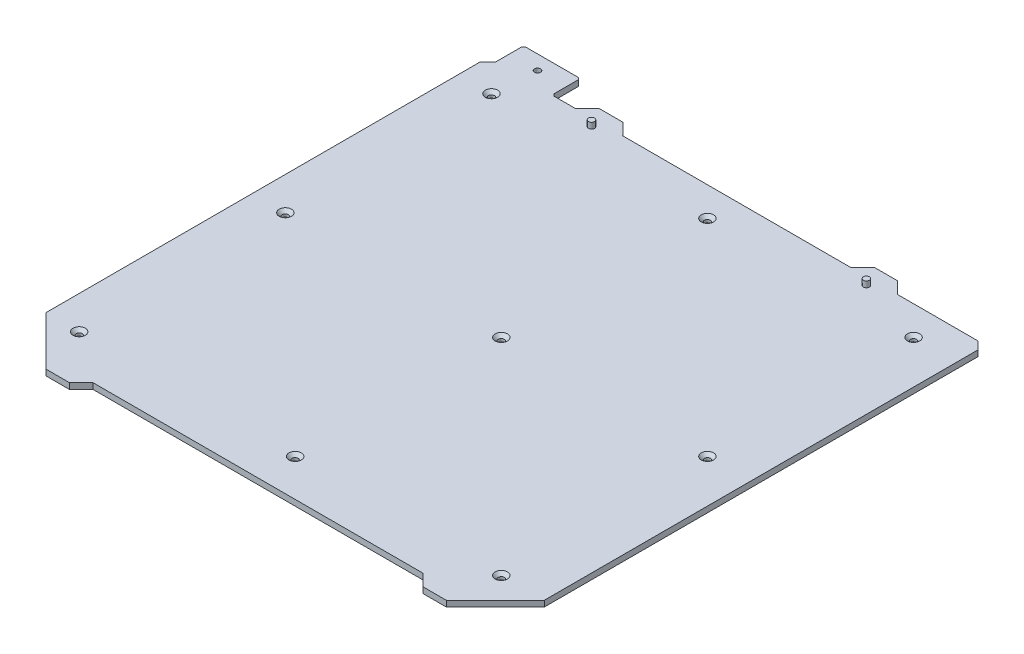
from build123d import *

# Parameters (mm, degrees)
BOSS_EXTRUDE1_DEPTH = 3
SKETCH2_R           = 1.55
CUT_EXTRUDE1_DEPTH  = 356.879522089
BOSS_EXTRUDE3_START = -6
SKETCH3_R           = 1.55
BOSS_EXTRUDE3_DEPTH = 6
CHAMFER1_SIZE       = 1.6


with BuildPart() as part:
    # Sketch1 → Boss-Extrude1 (new body)
    with BuildSketch(Plane(origin=(0, 0, 0), x_dir=(1, 0, 0), z_dir=(0, 1, 0))):
        Polygon((5.02071, 249.35), (4.05, 248.379), (4.05, 235), (4.04962, 234.998), (4.04981, 234.996), (4.04812, 234.989), (4.04698, 234.983), (4.04588, 234.981), (4.04531, 234.979), (4.04157, 234.974), (4.0383, 234.968), (4.03662, 234.966), (4.03536, 234.965), (0.096072974, 231.02453611), (0.100466918, 230.999536627), (0.100466918, 10.040936627), (25.04559171, -14.896738024), (36.96279171, -14.896738024), (42.932604901, -8.925141349), (42.936204527, -8.922620814), (42.939004026, -8.919250398), (42.950303055, -8.91270872), (42.961001942, -8.905217131), (42.965301773, -8.904076493), (42.969093555, -8.901881205), (42.981993376, -8.899610189), (42.99459311, -8.896229197), (42.99899314, -8.896608851), (43.00329308, -8.895848512), (211.00329308, -8.895848512), (211.00729308, -8.896608512), (211.01229308, -8.896228512), (211.02429308, -8.899608512), (211.03729308, -8.901878512), (211.04129308, -8.904078512), (211.04529308, -8.905218512), (211.05629308, -8.912718512), (211.06729308, -8.919248512), (211.07029308, -8.922608512), (211.07446368, -8.9293432), (217.045710314, -14.898806454), (228.963710314, -14.898806454), (253.901184996, 10.046118309), (253.901184996, 230.963718309), (249.95959644, 234.904129665), (209.00059644, 234.904129665), (208.966596216, 234.910128396), (208.936595582, 234.927127275), (208.913594574, 234.954126417), (208.902593341, 234.987126006), (208.902593341, 235.021126006), (208.904592744, 235.029126155), (202.978707894, 240.953241173), (191.020707894, 240.953241173), (185.096592876, 235.027356323), (185.098592876, 235.019356323), (185.098592876, 234.985356323), (185.087592876, 234.952356323), (185.064592876, 234.925356323), (185.034592876, 234.908356323), (185.000592876, 234.902356323), (69.000592876, 234.902356323), (68.966392876, 234.908356323), (68.936292876, 234.925356323), (68.913992876, 234.952356323), (68.902092876, 234.985356323), (68.902092876, 235.019356323), (68.904890404, 235.027357188), (62.979005555, 240.951472206), (51.020405555, 240.951472206), (45.096290537, 235.025587356), (45.099090537, 235.017587356), (45.099090537, 234.983587356), (45.087190537, 234.950587356), (45.064890537, 234.923587356), (45.034790537, 234.906587356), (45.000590537, 234.900587356), (34.000590537, 234.900587356), (33.966390537, 234.906587356), (33.936290537, 234.923587356), (33.913990537, 234.950587356), (33.902090537, 234.983587356), (33.902090537, 235.017587356), (33.904888065, 235.025588221), (32.964897694, 235.965297853), (32.963697694, 235.966297853), (32.961997694, 235.968297853), (32.958697694, 235.974297853), (32.954997694, 235.979297853), (32.954400114, 235.981289787), (32.953300114, 235.983289787), (32.95219879, 235.989297006), (32.950499346, 235.996294719), (32.950699249, 235.998293754), (32.9503, 236.00029), (32.9503, 248.37929), (31.9793, 249.35), align=None)
    extrude(amount=BOSS_EXTRUDE1_DEPTH)

    # Sketch2 → Cut-Extrude1 (cut, through all)
    with BuildSketch(Plane(origin=(0, 3, 0), x_dir=(1, 0, 0), z_dir=(0, 1, 0))):
        with Locations(Location((17.00329308, 10.040936627, 0), (0, 0, 270))):
            Circle(SKETCH2_R)
        with Locations(Location((127.00329308, 10.040936627, 0), (0, 0, 270))):
            Circle(SKETCH2_R)
        with Locations(Location((232.003293088, 10.040936627, 0), (0, 0, 270))):
            Circle(SKETCH2_R)
        with Locations(Location((232.002032216, 115.040936627, 0), (0, 0, 270))):
            Circle(SKETCH2_R)
        with Locations(Location((232.000771344, 220.040936627, 0), (0, 0, 270))):
            Circle(SKETCH2_R)
        with Locations(Location((127.002032208, 115.040936627, 0), (0, 0, 270))):
            Circle(SKETCH2_R)
        with Locations(Location((17.00329308, 115.040936627, 0), (0, 0, 270))):
            Circle(SKETCH2_R)
        with Locations(Location((17.00329308, 220.040936627, 0), (0, 0, 270))):
            Circle(SKETCH2_R)
        with Locations(Location((127.000771337, 220.040936627, 0), (0, 0, 270))):
            Circle(SKETCH2_R)
        with Locations(Location((196.999707894, 231.003241173, 0), (0, 0, 270))):
            Circle(SKETCH2_R)
        with Locations(Location((56.999705555, 231.003241173, 0), (0, 0, 270))):
            Circle(SKETCH2_R)
        with Locations(Location((18.499978099, 242, 0), (0, 0, 270))):
            Circle(SKETCH2_R)
    extrude(amount=-CUT_EXTRUDE1_DEPTH, mode=Mode.SUBTRACT)

    # Sketch3 → Boss-Extrude3 (add)
    with BuildSketch(Plane.XZ.offset(BOSS_EXTRUDE3_START)):
        with Locations(Location((56.999705555, -231.003241173, 0), (0, 0, 270))):
            Circle(SKETCH3_R)
        with Locations(Location((196.999707894, -231.003241173, 0), (0, 0, 270))):
            Circle(SKETCH3_R)
    extrude(amount=BOSS_EXTRUDE3_DEPTH)

    # Chamfer1
    chamfer1_edges = [part.edges().sort_by_distance(p)[0] for p in [
        (232.000771344, 3, -221.590936627),
        (232.002032216, 3, -116.590936627),
        (232.003293088, 3, -11.590936627),
        (127.002032208, 3, -116.590936627),
        (17.00329308, 3, -116.590936627),
        (127.000771337, 3, -221.590936627),
        (17.00329308, 3, -221.590936627),
        (127.00329308, 3, -11.590936627),
        (17.00329308, 3, -11.590936627),
    ]]
    chamfer(chamfer1_edges, length=CHAMFER1_SIZE)


solid = part.part
